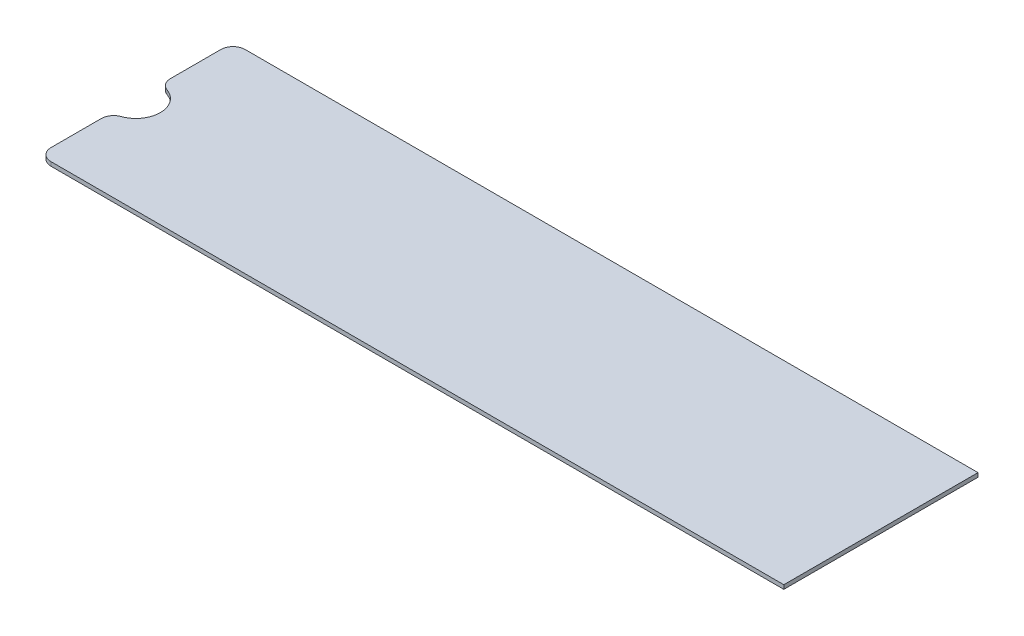
from build123d import *

# Parameters (mm, degrees)
BOSS_EXTRUDE1_DEPTH = 1.65
FILLET1_R           = 10


with BuildPart() as part:
    # Sketch1 → Boss-Extrude1 (new, symmetric)
    with BuildSketch(Plane(origin=(0, 0, 0), x_dir=(1, 0, 0), z_dir=(0, 1, 0))):
        with BuildLine():
            Line((-305, -20), (-305, -79.5))
            Line((-305, -79.5), (305, -79.5))
            Line((305, -79.5), (305, 79.5))
            Line((305, 79.5), (-305, 79.5))
            Line((-305, 79.5), (-305, 20))
            ThreePointArc((-305, 20), (-285, 0), (-305, -20))
        make_face()
    extrude(amount=BOSS_EXTRUDE1_DEPTH, both=True)

    # Fillet1
    fillet1_edges = [part.edges().sort_by_distance(p)[0] for p in [
        (-305, 0, -79.5),
        (-305, 0, 79.5),
        (-305, 0, 20),
        (-305, 0, -20),
    ]]
    fillet(fillet1_edges, radius=FILLET1_R)


solid = part.part
